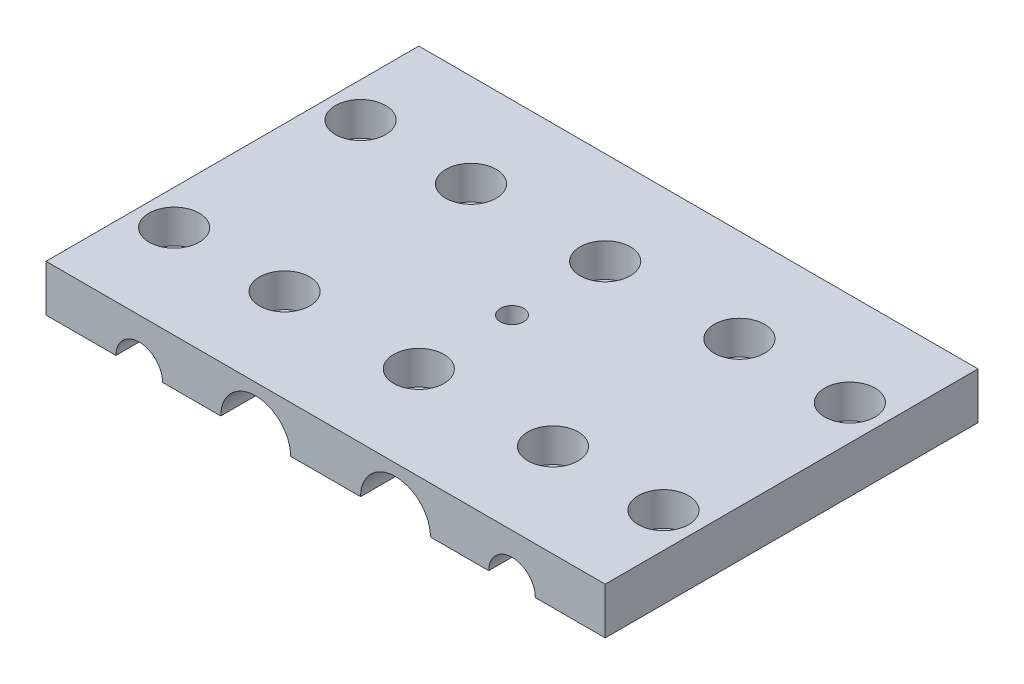
from build123d import *

# Parameters (mm, degrees)
SKETCH1_W             = 76.2
SKETCH1_H             = 50.8
BOSS_EXTRUDE1_DEPTH   = 6.35
SKETCH2_R             = 3.175
CUT_EXTRUDE1_DEPTH    = 64.816710194
SKETCH3_R             = 4.7625
CUT_EXTRUDE2_DEPTH    = 64.816710194
F_8_CLEARANCE_HOLE1_D = 4.4958
SKETCH6_R             = 3.429
CUT_EXTRUDE3_DEPTH    = 4.572
SKETCH7_R             = 1.5875
CUT_EXTRUDE4_DEPTH    = 47.228697797


with BuildPart() as part:
    # Sketch1 → Boss-Extrude1 (new body)
    with BuildSketch(Plane(origin=(0, 0, 0), x_dir=(1, 0, 0), z_dir=(0, 1, 0))):
        Rectangle(SKETCH1_W, SKETCH1_H)
    extrude(amount=BOSS_EXTRUDE1_DEPTH)

    # Sketch2 → Cut-Extrude1 (cut, through all)
    with BuildSketch(Plane.XY.offset(25.4)):
        with Locations((-25.4, 0)):
            Circle(SKETCH2_R)
        with Locations((25.4, 0)):
            Circle(SKETCH2_R)
    extrude(amount=-CUT_EXTRUDE1_DEPTH, mode=Mode.SUBTRACT)

    # Sketch3 → Cut-Extrude2 (cut, through all)
    with BuildSketch(Plane.XY.offset(25.4)):
        with Locations((-9.525, 0)):
            Circle(SKETCH3_R)
        with Locations((9.525, 0)):
            Circle(SKETCH3_R)
    extrude(amount=-CUT_EXTRUDE2_DEPTH, mode=Mode.SUBTRACT)

    # #8 Clearance Hole1 (through all)
    with Locations(Plane(origin=(0, 6.35, 0), x_dir=(1, 0, 0), z_dir=(0, 1, 0))):
        with Locations((-33.3375, 12.7), (-33.3375, -12.7), (-18.288, -12.7), (0, -12.7), (18.288, -12.7), (33.3375, -12.7), (33.3375, 12.7), (18.288, 12.7), (0, 12.7), (-18.288, 12.7)):
            Hole(F_8_CLEARANCE_HOLE1_D / 2)

    # Sketch6 → Cut-Extrude3 (cut)
    with BuildSketch(Plane(origin=(0, 6.35, 0), x_dir=(1, 0, 0), z_dir=(0, 1, 0))):
        with Locations(Location((-33.3375, 12.7, 0), (0, 0, 270))):
            Circle(SKETCH6_R)
        with Locations(Location((-18.288, 12.7, 0), (0, 0, 270))):
            Circle(SKETCH6_R)
        with Locations(Location((0, 12.7, 0), (0, 0, 270))):
            Circle(SKETCH6_R)
        with Locations(Location((18.288, 12.7, 0), (0, 0, 270))):
            Circle(SKETCH6_R)
        with Locations(Location((33.3375, 12.7, 0), (0, 0, 270))):
            Circle(SKETCH6_R)
        with Locations(Location((33.3375, -12.7, 0), (0, 0, 270))):
            Circle(SKETCH6_R)
        with Locations(Location((18.288, -12.7, 0), (0, 0, 270))):
            Circle(SKETCH6_R)
        with Locations(Location((0, -12.7, 0), (0, 0, 270))):
            Circle(SKETCH6_R)
        with Locations(Location((-18.288, -12.7, 0), (0, 0, 270))):
            Circle(SKETCH6_R)
        with Locations(Location((-33.3375, -12.7, 0), (0, 0, 270))):
            Circle(SKETCH6_R)
    extrude(amount=-CUT_EXTRUDE3_DEPTH, mode=Mode.SUBTRACT)

    # Sketch7 → Cut-Extrude4 (cut, through all)
    with BuildSketch(Plane(origin=(0, 6.35, 0), x_dir=(1, 0, 0), z_dir=(0, 1, 0))):
        with Locations(Location((0, 0, 0), (0, 0, 270))):
            Circle(SKETCH7_R)
    extrude(amount=-CUT_EXTRUDE4_DEPTH, mode=Mode.SUBTRACT)


solid = part.part
